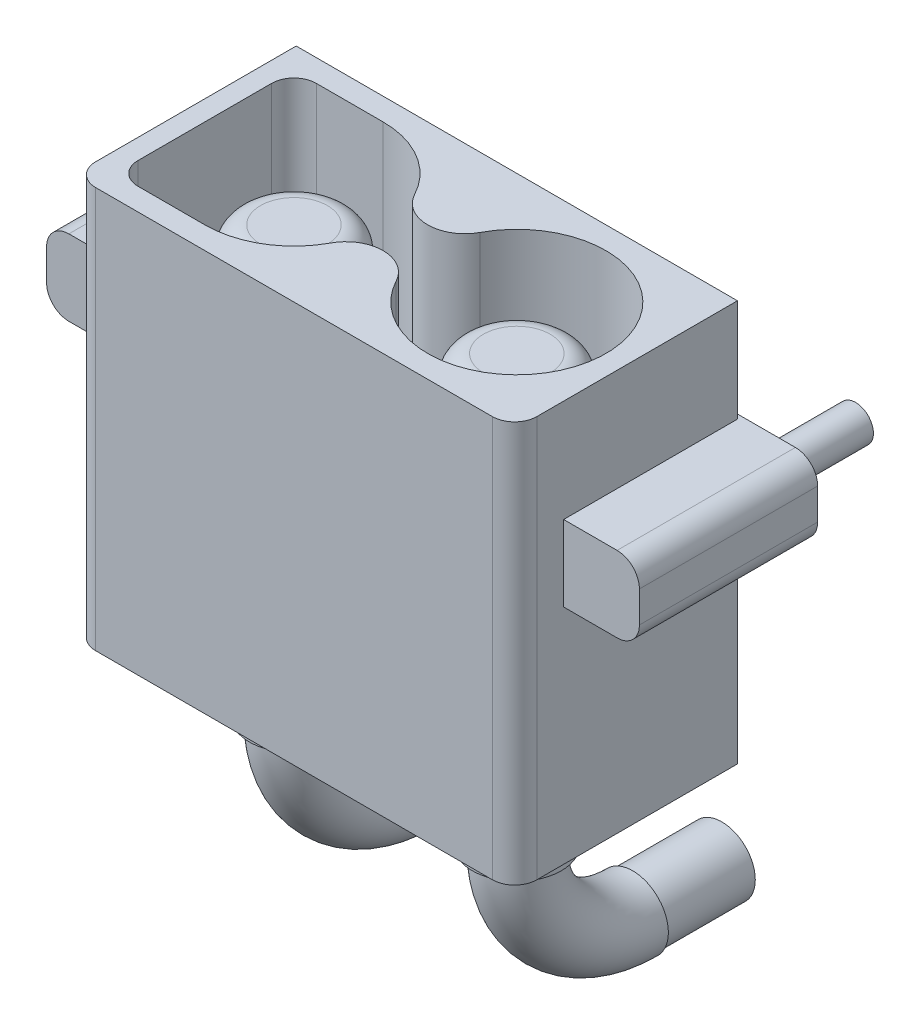
from build123d import *
from build123d.topology import SkipClean

# Parameters (mm, degrees)
SKETCH_1_R             = 0.75
EXTRUDE_1_DEPTH        = 2
SKETCH_2_R             = 0.8
SKETCH_4_R             = 1
EXTRUDE_2_DEPTH        = 1.55
SKETCH_5_W             = 9.9
SKETCH_5_H             = 5
EXTRUDE_3_DEPTH        = 9
SKETCH_8_R             = 0.4
EXTRUDE_5_DEPTH        = 2
EXTRUDE_5_2_DEPTH      = 2
SKETCH_9_W             = 2.7
SKETCH_9_H             = 1.7
EXTRUDE_6_DEPTH        = 4
CUT_EXTRUDE_3_DEPTH    = 7
SKETCH_7_R             = 1.25
EXTRUDE_7_DEPTH        = 6
PATTERN_LINEAR_1_COUNT = 2
PATTERN_LINEAR_1_PITCH = 5
EXTRUDE_8_DEPTH        = 7
FILLET_1_R             = 0.5
FILLET_2_R             = 0.5
FILLET_4_R             = 0.5
FILLET_5_R             = 0.5


with BuildPart() as part:
    # ｽｹｯﾁ1 → ﾎﾞｽ - 押し出し1 (new body)
    with BuildSketch(Plane.XY):
        Circle(SKETCH_1_R)
    extrude_1 = extrude(amount=-EXTRUDE_1_DEPTH)

    # ｽｲｰﾌﾟ1: sweep along a path in ｽｹｯﾁ3
    with BuildLine(Plane(origin=(0, 0, 0), x_dir=(0, 0, -1), z_dir=(1, 0, 0))) as sweep_1_path:
        ThreePointArc((0, 0), (-1.838477631, 0.761522369), (-2.6, 2.6))
    # ｽｹｯﾁ2 → ｽｲｰﾌﾟ1 (sweep)
    with BuildSketch(Plane.XY):
        Circle(SKETCH_2_R)
    sweep_1 = sweep(path=sweep_1_path.line)

    # ｽｹｯﾁ4 → ﾎﾞｽ - 押し出し2 (add)
    with BuildSketch(Plane(origin=(0, 2.6, 0), x_dir=(1, 0, 0), z_dir=(0, 1, 0))):
        with Locations(Location((0, -2.6, 0), (0, 0, 90))):
            Circle(SKETCH_4_R)
    extrude_2 = extrude(amount=EXTRUDE_2_DEPTH)

    # ｽｹｯﾁ5 → ﾎﾞｽ - 押し出し3 (add)
    with BuildSketch(Plane(origin=(0, 4.15, 0), x_dir=(1, 0, 0), z_dir=(0, 1, 0))):
        with Locations((-2.5, -2.6)):
            Rectangle(SKETCH_5_W, SKETCH_5_H)
    extrude(amount=EXTRUDE_3_DEPTH)



with BuildPart() as body_2:
    # ｽｹｯﾁ8 → ﾎﾞｽ - 押し出し5 (new body)
    with BuildSketch(Plane.XY):
        with Locations((-8, 10)):
            Circle(SKETCH_8_R)
    extrude(amount=-EXTRUDE_5_DEPTH)


with BuildPart() as body_3:
    # ｽｹｯﾁ8 → Extrude 5 2 (new body)
    with BuildSketch(Plane.XY):
        with Locations((3, 10)):
            Circle(SKETCH_8_R)
    extrude(amount=-EXTRUDE_5_2_DEPTH)


with BuildPart() as part_1:
    add(part.part)

    add(body_2.part)  # ﾎﾞｽ - 押し出し6 merges body 2

    add(body_3.part)  # ﾎﾞｽ - 押し出し6 merges body 3
    # ｽｹｯﾁ9 → ﾎﾞｽ - 押し出し6 (add)
    with BuildSketch(Plane.XY):
        with Locations((-7.8, 10)):
            Rectangle(SKETCH_9_W, SKETCH_9_H)
        with Locations((2.8, 10)):
            Rectangle(SKETCH_9_W, SKETCH_9_H)
    extrude(amount=EXTRUDE_6_DEPTH)

    # ｽｹｯﾁ6 → ｶｯﾄ - 押し出し3 (cut)
    with BuildSketch(Plane(origin=(0, 13.15, 0), x_dir=(1, 0, 0), z_dir=(0, 1, 0))):
        with BuildLine():
            Line((0, -0.6), (-7, -0.6))
            Line((-7, -0.6), (-7, -4.6))
            Line((-7, -4.6), (0, -4.6))
            ThreePointArc((0, -4.6), (2, -2.6), (0, -0.6))
        make_face()
    extrude(amount=-CUT_EXTRUDE_3_DEPTH, mode=Mode.SUBTRACT)

    # ｽｹｯﾁ7 → ﾎﾞｽ - 押し出し7 (add)
    with BuildSketch(Plane(origin=(0, 6.15, 0), x_dir=(1, 0, 0), z_dir=(0, 1, 0))):
        with Locations(Location((0, -2.6, 0), (0, 0, 90))):
            Circle(SKETCH_7_R)
    extrude_7 = extrude(amount=EXTRUDE_7_DEPTH)

    # 直線ﾊﾟﾀｰﾝ1: ﾎﾞｽ - 押し出し1, ｽｲｰﾌﾟ1, ﾎﾞｽ - 押し出し2, ﾎﾞｽ - 押し出し7 ×2
    with Locations(*[(-i * PATTERN_LINEAR_1_PITCH, 0, 0) for i in range(1, PATTERN_LINEAR_1_COUNT)]):
        add(extrude_1)
        add(sweep_1)
        add(extrude_2)
        add(extrude_7)

    # ｽｹｯﾁ10 → ﾎﾞｽ - 押し出し8 (add)
    with BuildSketch(Plane(origin=(0, 13.15, 0), x_dir=(1, 0, 0), z_dir=(0, 1, 0))):
        with BuildLine():
            Line((-5, -0.6), (0, -0.6))
            ThreePointArc((0, -0.6), (-1.028991511, -0.885014149), (-1.764705882, -1.658823529))
            ThreePointArc((-1.764705882, -1.658823529), (-2.5, -2.1), (-3.235294118, -1.658823529))
            ThreePointArc((-3.235294118, -1.658823529), (-3.971008489, -0.885014149), (-5, -0.6))
        make_face()
    extrude_8 = extrude(amount=-EXTRUDE_8_DEPTH)

    # ﾐﾗｰ2: ﾎﾞｽ - 押し出し8 across plane
    with SkipClean():  # the faces are left unmerged after this step: merging them gives an invalid solid
        add(extrude_8.mirror(Plane(origin=(0, 0, 2.6), x_dir=(1, 0, 0), z_dir=(0, 0, -1))))

    # ﾌｨﾚｯﾄ1
    fillet_1_edges = [part_1.edges().sort_by_distance(p)[0] for p in [
        (-9.15, 9.15, 2),
        (-9.15, 10.85, 2),
        (4.15, 10.85, 2),
        (4.15, 9.15, 2),
    ]]
    fillet(fillet_1_edges, radius=FILLET_1_R)

    # ﾌｨﾚｯﾄ2
    fillet_2_edges = [part_1.edges().sort_by_distance(p)[0] for p in [
        (-7.45, 8.65, 5.1),
        (2.45, 8.65, 5.1),
    ]]
    fillet(fillet_2_edges, radius=FILLET_2_R)

    # ﾌｨﾚｯﾄ4
    fillet_4_edges = [part_1.edges().sort_by_distance(p)[0] for p in [
        (-7, 9.65, 4.6),
        (-7, 9.65, 0.6),
    ]]
    fillet(fillet_4_edges, radius=FILLET_4_R)

    # ﾌｨﾚｯﾄ5
    fillet_5_edges = [part_1.edges().sort_by_distance(p)[0] for p in [
        (0, 12.15, 3.85),
        (-5, 12.15, 3.85),
    ]]
    fillet(fillet_5_edges, radius=FILLET_5_R)


solid = part_1.part
